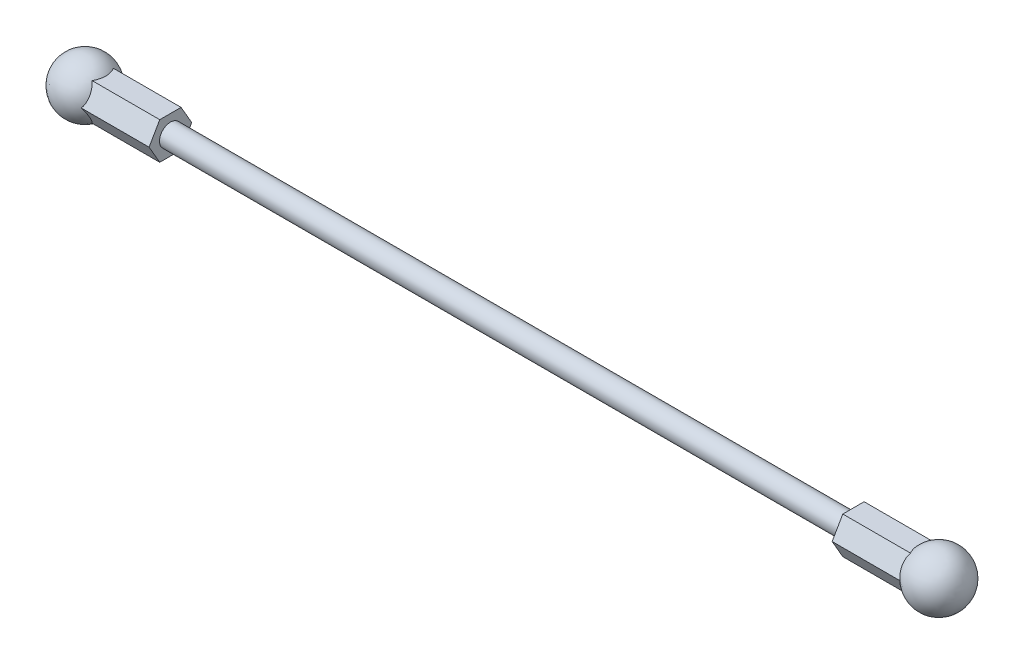
from build123d import *

# Parameters (mm, degrees)
BOSS_EXTRUDE2_DEPTH = 9.25
SKETCH5_R           = 1.190625
BOSS_EXTRUDE3_DEPTH = 74


with BuildPart() as part:
    # Sketch2 → Revolve1 (revolve)
    with BuildSketch(Plane.XY):
        with BuildLine():
            Line((0, 3), (0, -3))
            ThreePointArc((0, -3), (3, 0), (0, 3))
        make_face()
    revolve(axis=Axis((0, 3, 0), (0, -1, 0)))

    # Sketch3 → Boss-Extrude2 (add)
    with BuildSketch(Plane(origin=(0, 0, 0), x_dir=(0, 0, -1), z_dir=(1, 0, 0))):
        Polygon((1.154700538, -2), (2.309401077, 0), (1.154700538, 2), (-1.154700538, 2), (-2.309401077, 0), (-1.154700538, -2), align=None)
    boss_extrude2 = extrude(amount=BOSS_EXTRUDE2_DEPTH)

    # Sketch5 → Boss-Extrude3 (add)
    with BuildSketch(Plane(origin=(9.25, 0, 0), x_dir=(0, 0, -1), z_dir=(1, 0, 0))):
        with Locations(Location((0.007936131, 0, 0), (0, 0, 180))):
            Circle(SKETCH5_R)
    extrude(amount=BOSS_EXTRUDE3_DEPTH)


with BuildPart() as body_2:
    # Sketch7 → Revolve2 (revolve)
    with BuildSketch(Plane(origin=(92.5, 0, 0), x_dir=(0, 0, -1), z_dir=(1, 0, 0))):
        with BuildLine():
            ThreePointArc((0, 3), (3, 0), (0, -3))
            Line((0, -3), (0, 3))
        make_face()
    revolve(axis=Axis((92.5, 3, 0), (0, -1, 0)))

    # Mirror3: Boss-Extrude2 across plane
    add(boss_extrude2.mirror(Plane(origin=(46.25, 0, 0), x_dir=(0, 0, 1), z_dir=(1, 0, 0))))


solid = Compound([part.part, body_2.part])
